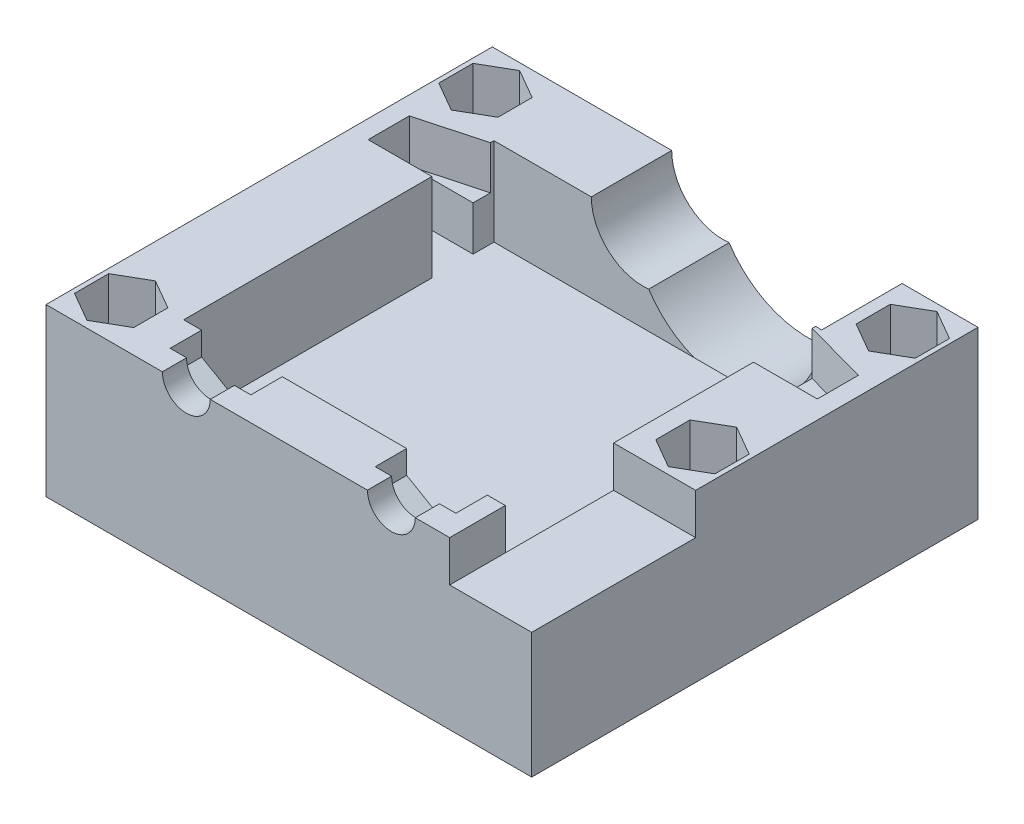
from build123d import *

# Parameters (mm, degrees)
SKETCH1_W           = 35.519995
SKETCH1_H           = 32.639
BOSS_EXTRUDE1_DEPTH = 12.1700036
CUT_EXTRUDE1_DEPTH  = 5.2500022
SKETCH3_R           = 1.2499975
CUT_EXTRUDE2_DEPTH  = 28.015783888
SKETCH4_W           = 5.999988
SKETCH4_H           = 11.9888
CUT_EXTRUDE3_DEPTH  = 2.999994
SKETCH5_W           = 23.5199936
SKETCH5_H           = 22.6899978
CUT_EXTRUDE4_DEPTH  = 6.4250062
SKETCH6_R           = 1.7499965
CUT_EXTRUDE5_DEPTH  = 4.069988812
CUT_EXTRUDE6_DEPTH  = 2.2999954
CUT_EXTRUDE7_DEPTH  = 3.175
CUT_EXTRUDE8_REACH  = 29.016
SKETCH9_W           = 4.664964
SKETCH9_H           = 3.0100016
CUT_EXTRUDE9_DEPTH  = 5.879013388


with BuildPart() as part:
    # Sketch1 → Boss-Extrude1 (new body)
    with BuildSketch(Plane(origin=(0, 0, 0), x_dir=(1, 0, 0), z_dir=(0, 1, 0))):
        Rectangle(SKETCH1_W, SKETCH1_H)
    extrude(amount=BOSS_EXTRUDE1_DEPTH)

    # Sketch2 → Cut-Extrude1 (cut)
    with BuildSketch(Plane(origin=(0, 12.1700036, 0), x_dir=(1, 0, 0), z_dir=(0, 1, 0))):
        Polygon((-15.2600025, -10.819511), (-17.425061679, -12.0695085), (-17.425061679, -14.5695035), (-15.2600025, -15.819501), (-13.094943321, -14.5695035), (-13.094943321, -12.0695085), align=None)
        Polygon((-13.094943321, 12.0695085), (-15.2600025, 10.819511), (-17.425061679, 12.0695085), (-17.425061679, 14.5695035), (-15.2600025, 15.819501), (-13.094943321, 14.5695035), align=None)
        Polygon((17.425061679, 12.0695085), (17.425061679, 14.5695035), (15.2600025, 15.819501), (13.094943321, 14.5695035), (13.094943321, 12.0695085), (15.2600025, 10.819511), align=None)
        Polygon((15.2600025, 1.1695176), (13.094943321, -0.0804799), (13.094943321, -2.5804749), (15.2600025, -3.8304724), (17.425061679, -2.5804749), (17.425061679, -0.0804799), align=None)
    extrude(amount=-CUT_EXTRUDE1_DEPTH, mode=Mode.SUBTRACT)

    # Sketch3 → Cut-Extrude2 (cut, through all)
    with BuildSketch(Plane(origin=(0, 12.1700036, 0), x_dir=(1, 0, 0), z_dir=(0, 1, 0))):
        with Locations(Location((-15.2600025, 13.319506, 0), (0, 0, 270))):
            Circle(SKETCH3_R)
        with Locations(Location((15.2600025, 13.319506, 0), (0, 0, 270))):
            Circle(SKETCH3_R)
        with Locations(Location((-15.2600025, -13.319506, 0), (0, 0, 270))):
            Circle(SKETCH3_R)
        with Locations(Location((15.2600025, -1.3304774, 0), (0, 0, 270))):
            Circle(SKETCH3_R)
    extrude(amount=-CUT_EXTRUDE2_DEPTH, mode=Mode.SUBTRACT)

    # Sketch4 → Cut-Extrude3 (cut)
    with BuildSketch(Plane(origin=(0, 12.1700036, 0), x_dir=(1, 0, 0), z_dir=(0, 1, 0))):
        with Locations((14.7600035, -10.3251)):
            Rectangle(SKETCH4_W, SKETCH4_H)
    extrude(amount=-CUT_EXTRUDE3_DEPTH, mode=Mode.SUBTRACT)

    # Sketch5 → Cut-Extrude4 (cut)
    with BuildSketch(Plane(origin=(0, 12.1700036, 0), x_dir=(1, 0, 0), z_dir=(0, 1, 0))):
        with Locations((1.27e-05, -0.904512288)):
            Rectangle(SKETCH5_W, SKETCH5_H)
    extrude(amount=-CUT_EXTRUDE4_DEPTH, mode=Mode.SUBTRACT)

    # Sketch6 → Cut-Extrude5 (cut)
    with BuildSketch(Plane.XY.offset(16.3195)):
        with Locations((-7.5000104, 12.1700036)):
            Circle(SKETCH6_R)
        with Locations((7.49596799, 12.1700036)):
            Circle(SKETCH6_R)
    extrude(amount=-CUT_EXTRUDE5_DEPTH, mode=Mode.SUBTRACT)

    # Sketch7 → Cut-Extrude6 (cut)
    with BuildSketch(Plane(origin=(0, 0, 12.249511188), x_dir=(-1, 0, 0), z_dir=(0, 0, -1))):
        Polygon((-7.49596799, 8.763635), (-4.545966248, 10.4668193), (-4.545966248, 13.8731879), (-7.49596799, 15.5763722), (-10.445969732, 13.8731879), (-10.445969732, 10.4668193), align=None)
        Polygon((7.5000104, 8.763635), (10.450012142, 10.4668193), (10.450012142, 13.8731879), (7.5000104, 15.5763722), (4.550008658, 13.8731879), (4.550008658, 10.4668193), align=None)
    extrude(amount=-CUT_EXTRUDE6_DEPTH, mode=Mode.SUBTRACT)

    # Sketch8 → Cut-Extrude7 (cut)
    with BuildSketch(Plane(origin=(0, 12.1700036, 0), x_dir=(1, 0, 0), z_dir=(0, 1, 0))):
        Polygon((11.7600095, 10.183495), (16.4249989, 8.913495), (11.7600095, 8.913495), align=None)
        Polygon((-11.7599841, 8.913495), (-11.7599841, 10.183495), (-16.4249735, 8.913495), align=None)
    extrude(amount=-CUT_EXTRUDE7_DEPTH, mode=Mode.SUBTRACT)

    # Cut-Extrude8: up to this face of the body (flat: up to its plane)
    cut_extrude8_end = Plane(part.part.faces().sort_by_distance((1.27e-05, 5.7449974, 0.904512288))[0])
    # Sketch9 → Cut-Extrude8 (cut, up to the picked face)
    with BuildSketch(Plane(origin=(0, 12.1700036, 0), x_dir=(1, 0, 0), z_dir=(0, 1, 0)), mode=Mode.PRIVATE) as cut_extrude8_sk1:
        with Locations((-14.0924661, 7.4084942)):
            Rectangle(SKETCH9_W, SKETCH9_H)
    cut_extrude8_tool1 = split(extrude(cut_extrude8_sk1.sketch, amount=-CUT_EXTRUDE8_REACH, mode=Mode.PRIVATE), bisect_by=cut_extrude8_end, keep=Keep.BOTH, mode=Mode.PRIVATE)
    # Sketch9 → Cut-Extrude8 (cut, up to the picked face)
    with BuildSketch(Plane(origin=(0, 12.1700036, 0), x_dir=(1, 0, 0), z_dir=(0, 1, 0)), mode=Mode.PRIVATE) as cut_extrude8_sk2:
        with Locations((14.0924915, 7.4084942)):
            Rectangle(SKETCH9_W, SKETCH9_H)
    cut_extrude8_tool2 = split(extrude(cut_extrude8_sk2.sketch, amount=-CUT_EXTRUDE8_REACH, mode=Mode.PRIVATE), bisect_by=cut_extrude8_end, keep=Keep.BOTH, mode=Mode.PRIVATE)
    add(cut_extrude8_tool1.solids().sort_by(Axis((-14.092466, 12.170004, -7.408494), (0, -1, 0)))[0], mode=Mode.SUBTRACT)
    add(cut_extrude8_tool2.solids().sort_by(Axis((14.092492, 12.170004, -7.408494), (0, -1, 0)))[0], mode=Mode.SUBTRACT)

    # Sketch10 → Cut-Extrude9 (cut)
    with BuildSketch(Plane(origin=(0, 0, -16.3195), x_dir=(-1, 0, 0), z_dir=(0, 0, -1))):
        with BuildLine():
            Line((-12.2099959, 12.1700036), (4.6400085, 12.1700036))
            ThreePointArc((4.6400085, 12.1700036), (3.379044213, 9.357714974), (0.44043921, 8.42841476))
            ThreePointArc((0.44043921, 8.42841476), (-7.282364219, 5.573925305), (-12.2099959, 12.1700036))
        make_face()
    extrude(amount=-CUT_EXTRUDE9_DEPTH, mode=Mode.SUBTRACT)


solid = part.part
